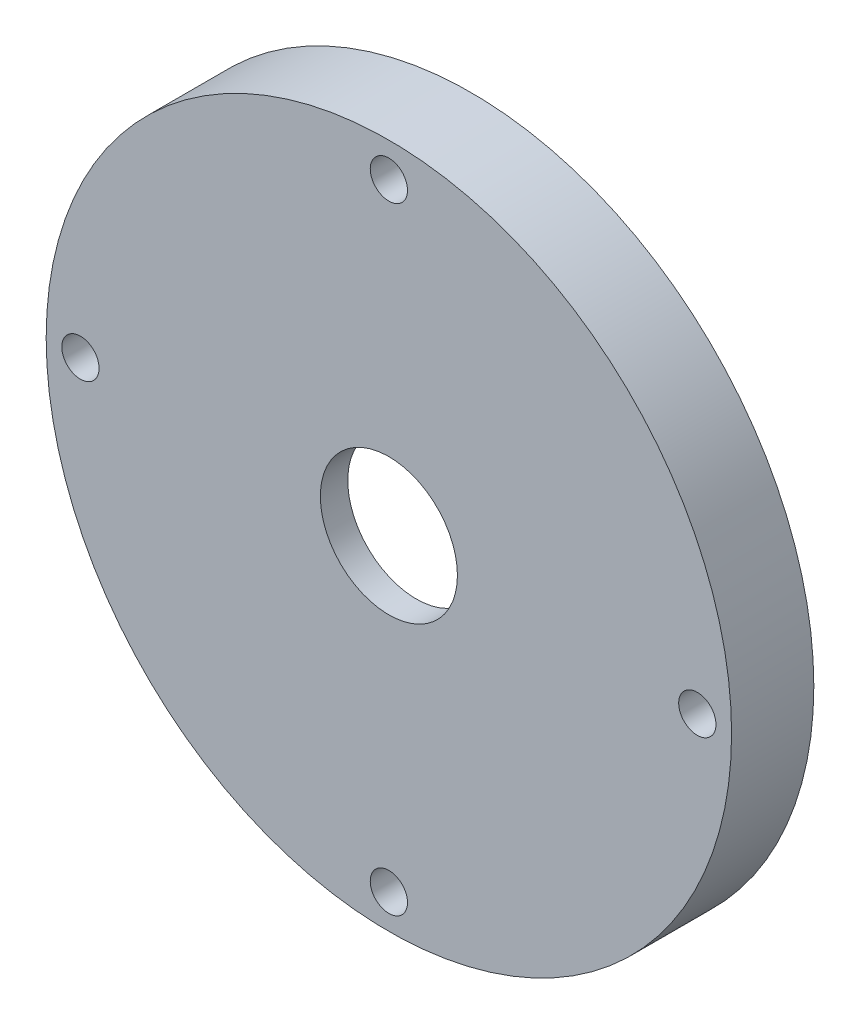
from build123d import *

# Parameters (mm, degrees)
SKETCH1_R           = 31.75
SKETCH1_R_2         = 21.59
BOSS_EXTRUDE1_DEPTH = 5.08
SKETCH2_R           = 31.75
BOSS_EXTRUDE2_DEPTH = 2.54
SKETCH3_R           = 1.7272
CUT_EXTRUDE1_DEPTH  = 7.62
SKETCH4_R           = 6.35
CUT_EXTRUDE2_DEPTH  = 2.54


with BuildPart() as part:
    # Sketch1 → Boss-Extrude1 (new body)
    with BuildSketch(Plane.XY):
        Circle(SKETCH1_R)
        Circle(SKETCH1_R_2, mode=Mode.SUBTRACT)
    extrude(amount=BOSS_EXTRUDE1_DEPTH)

    # Sketch2 → Boss-Extrude2 (add)
    with BuildSketch(Plane.XY.offset(5.08)):
        Circle(SKETCH2_R)
    extrude(amount=BOSS_EXTRUDE2_DEPTH)

    # Sketch3 → Cut-Extrude1 (cut)
    with BuildSketch(Plane(origin=(0, 0, 0), x_dir=(-1, 0, 0), z_dir=(0, 0, -1))):
        with Locations((0, 28.575)):
            Circle(SKETCH3_R)
        with Locations((28.575, 0)):
            Circle(SKETCH3_R)
        with Locations((0, -28.575)):
            Circle(SKETCH3_R)
        with Locations((-28.575, 0)):
            Circle(SKETCH3_R)
    extrude(amount=-CUT_EXTRUDE1_DEPTH, mode=Mode.SUBTRACT)

    # Sketch4 → Cut-Extrude2 (cut)
    with BuildSketch(Plane.XY.offset(7.62)):
        Circle(SKETCH4_R)
    extrude(amount=-CUT_EXTRUDE2_DEPTH, mode=Mode.SUBTRACT)


solid = part.part
